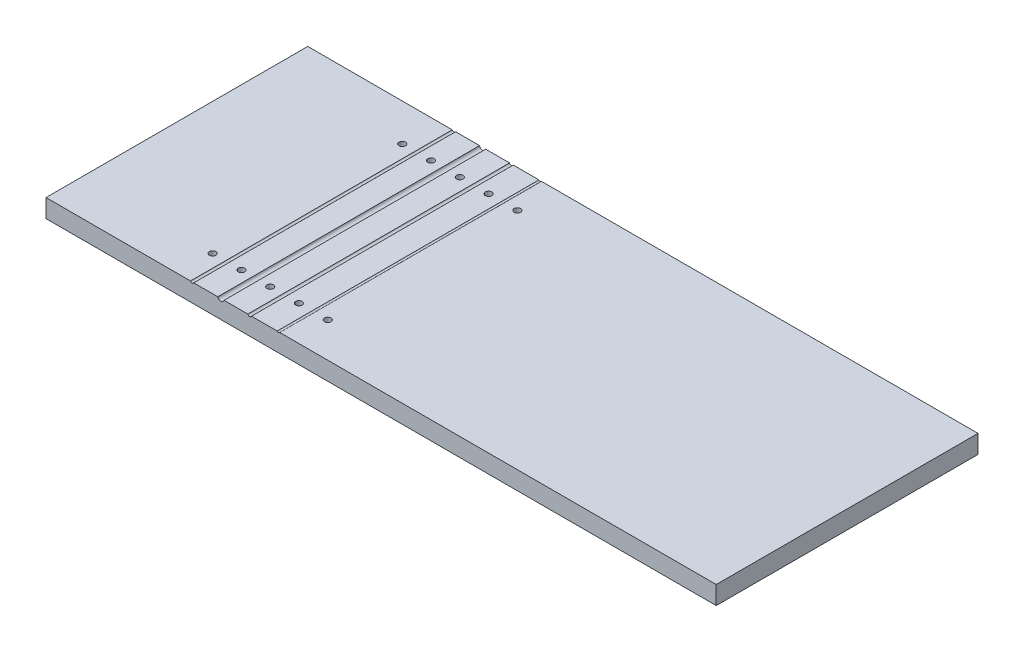
from build123d import *

# Parameters (mm, degrees)
SKETCH1_W             = 233
SKETCH1_H             = 91
BOSS_EXTRUDE1_DEPTH   = 6.35
SKETCH2_R             = 0.6223
SKETCH2_R_2           = 1.1
SKETCH2_R_3           = 0.6858
SKETCH2_R_4           = 0.5
CUT_EXTRUDE1_DEPTH    = 245.291275438
F_4_40_TAPPED_HOLE1_D = 2.2606


with BuildPart() as part:
    # Sketch1 → Boss-Extrude1 (new body)
    with BuildSketch(Plane(origin=(0, 0, 0), x_dir=(1, 0, 0), z_dir=(0, 1, 0))):
        with Locations((110.120618557, 39.933676976)):
            Rectangle(SKETCH1_W, SKETCH1_H)
    extrude(amount=BOSS_EXTRUDE1_DEPTH)

    # Sketch2 → Cut-Extrude1 (cut, through all)
    with BuildSketch(Plane.XY.offset(5.566323024)):
        with Locations((44.420618557, 6.6)):
            Circle(SKETCH2_R)
        with Locations((54.420618557, 6.6)):
            Circle(SKETCH2_R_2)
        with Locations((64.420618557, 6.6)):
            Circle(SKETCH2_R_3)
        with Locations((74.420618557, 6.6)):
            Circle(SKETCH2_R_4)
    extrude(amount=-CUT_EXTRUDE1_DEPTH, mode=Mode.SUBTRACT)

    # #4-40 Tapped Hole1 (through all)
    with Locations(Plane(origin=(0, 6.35, 0), x_dir=(1, 0, 0), z_dir=(0, 1, 0))):
        with Locations((39.420618557, 72.491246031), (59.420618557, 72.491246031), (49.420618557, 72.491246031), (49.420618557, 6.5743166), (39.420618557, 6.5743166), (59.420618557, 6.5743166), (69.420618557, 72.491246031), (79.420618557, 72.491246031), (69.420618557, 6.5743166), (79.420618557, 6.5743166)):
            Hole(F_4_40_TAPPED_HOLE1_D / 2)


solid = part.part
